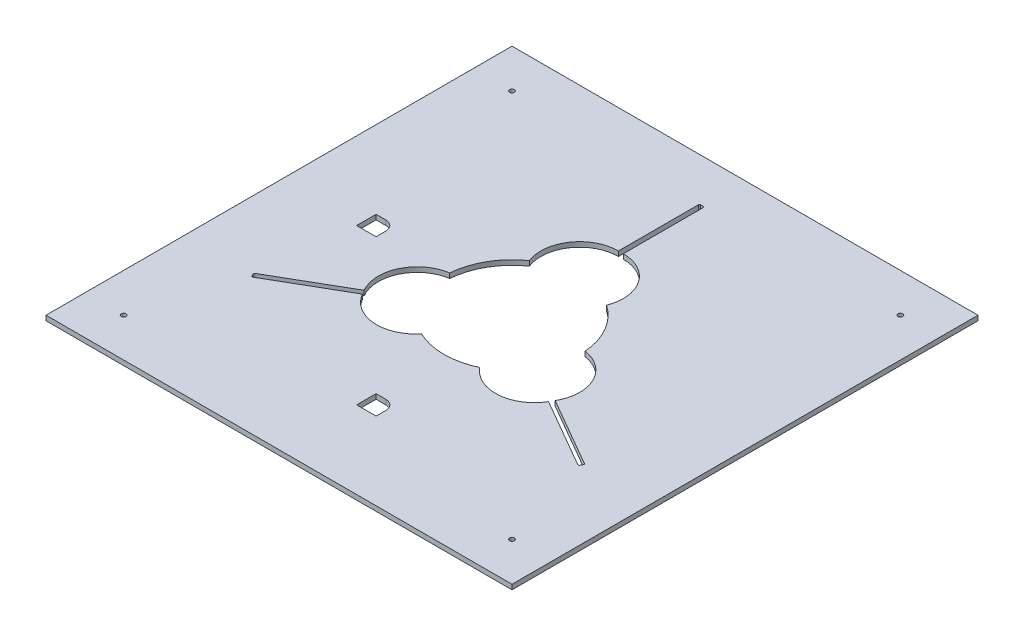
from build123d import *

# Parameters (mm, degrees)
SKETCH1_W           = 609.6
SKETCH1_H           = 609.6
BOSS_EXTRUDE1_DEPTH = 6.35
CUT_EXTRUDE2_DEPTH  = 432.099063441
SKETCH4_W           = 25.4
SKETCH4_H           = 25.4
CUT_EXTRUDE8_DEPTH  = 432.099063441
FILLET4_R           = 12.7
FILLET5_R           = 12.7
SKETCH5_R           = 3.175
CUT_EXTRUDE9_DEPTH  = 432.099063441
FILLET9_R           = 1.5875


with BuildPart() as part:
    # Sketch1 → Boss-Extrude1 (new body)
    with BuildSketch(Plane(origin=(0, 0, 0), x_dir=(1, 0, 0), z_dir=(0, 1, 0))):
        Rectangle(SKETCH1_W, SKETCH1_H)
    extrude(amount=BOSS_EXTRUDE1_DEPTH)

    # Sketch3 → Cut-Extrude2 (cut, through all)
    with BuildSketch(Plane(origin=(0, 0, 0), x_dir=(1, 0, 0), z_dir=(0, 1, 0))):
        with BuildLine():
            Line((-3.175, 248.4755), (-3.175, 142.454689298))
            ThreePointArc((-3.175, 142.454689298), (-45.125573361, 120.304111538), (-50.492310608, 73.169232396))
            ThreePointArc((-50.492310608, 73.169232396), (-76.989658396, 44.45), (-88.612569335, 7.143007484))
            ThreePointArc((-88.612569335, 7.143007484), (-126.749203452, -21.072162878), (-124.95687982, -68.477713992))
            Line((-124.95687982, -68.477713992), (-216.773595218, -121.488119343))
            Line((-216.773595218, -121.488119343), (-213.598595218, -126.987380657))
            Line((-213.598595218, -126.987380657), (-121.78187982, -73.976975306))
            ThreePointArc((-121.78187982, -73.976975306), (-81.623630091, -99.23194866), (-38.120258727, -80.31223988))
            ThreePointArc((-38.120258727, -80.31223988), (0, -88.9), (38.120258727, -80.31223988))
            ThreePointArc((38.120258727, -80.31223988), (81.623630091, -99.23194866), (121.78187982, -73.976975306))
            Line((121.78187982, -73.976975306), (213.598595218, -126.987380657))
            Line((213.598595218, -126.987380657), (216.773595218, -121.488119343))
            Line((216.773595218, -121.488119343), (124.95687982, -68.477713992))
            ThreePointArc((124.95687982, -68.477713992), (126.749203452, -21.072162878), (88.612569335, 7.143007484))
            ThreePointArc((88.612569335, 7.143007484), (76.989658396, 44.45), (50.492310608, 73.169232396))
            ThreePointArc((50.492310608, 73.169232396), (45.125573361, 120.304111538), (3.175, 142.454689298))
            Line((3.175, 142.454689298), (3.175, 248.4755))
            Line((3.175, 248.4755), (-3.175, 248.4755))
        make_face()
    extrude(amount=CUT_EXTRUDE2_DEPTH, mode=Mode.SUBTRACT)

    # Sketch4 → Cut-Extrude8 (cut, through all)
    with BuildSketch(Plane(origin=(0, 0, 0), x_dir=(1, 0, 0), z_dir=(0, 1, 0))):
        with Locations((12.7, -190.5)):
            Rectangle(SKETCH4_W, SKETCH4_H)
        with Locations((-190.5, 12.7)):
            Rectangle(SKETCH4_W, SKETCH4_H)
    extrude(amount=CUT_EXTRUDE8_DEPTH, mode=Mode.SUBTRACT)

    # Fillet4
    fillet4_edges = [part.edges().sort_by_distance(p)[0] for p in [
        (-177.8, 3.175, -25.4),
    ]]
    fillet(fillet4_edges, radius=FILLET4_R)

    # Fillet5
    fillet5_edges = [part.edges().sort_by_distance(p)[0] for p in [
        (25.4, 3.175, 177.8),
    ]]
    fillet(fillet5_edges, radius=FILLET5_R)

    # Sketch5 → Cut-Extrude9 (cut, through all)
    with BuildSketch(Plane(origin=(0, 6.35, 0), x_dir=(1, 0, 0), z_dir=(0, 1, 0))):
        with Locations(Location((-254, 254, 0), (0, 0, 270))):
            Circle(SKETCH5_R)
        with Locations(Location((254, 254, 0), (0, 0, 270))):
            Circle(SKETCH5_R)
        with Locations(Location((254, -254, 0), (0, 0, 270))):
            Circle(SKETCH5_R)
        with Locations(Location((-254, -254, 0), (0, 0, 270))):
            Circle(SKETCH5_R)
    extrude(amount=-CUT_EXTRUDE9_DEPTH, mode=Mode.SUBTRACT)

    # Fillet9
    fillet9_edges = [part.edges().sort_by_distance(p)[0] for p in [
        (3.175, 3.175, -248.4755),
        (-3.175, 3.175, -248.4755),
        (-216.773595218, 3.175, 121.488119343),
        (-213.598595218, 3.175, 126.987380657),
        (213.598595218, 3.175, 126.987380657),
        (216.773595218, 3.175, 121.488119343),
    ]]
    fillet(fillet9_edges, radius=FILLET9_R)


solid = part.part
